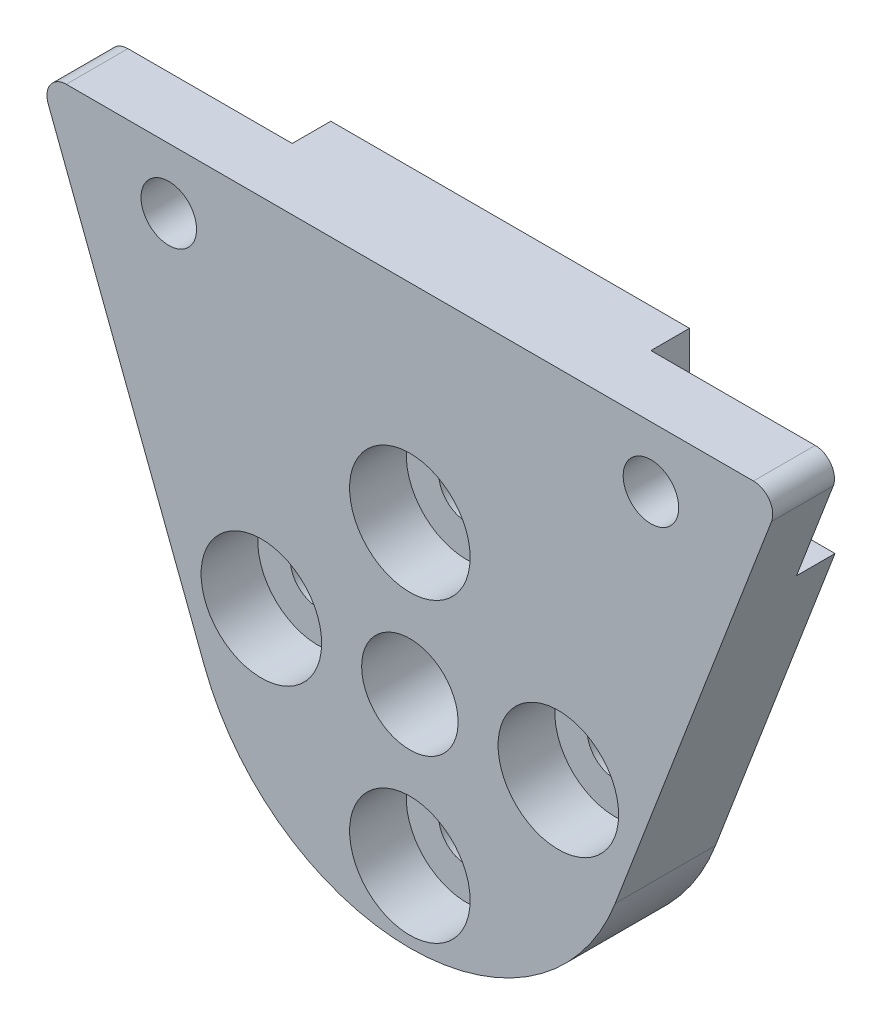
from build123d import *

# Parameters (mm, degrees)
SKETCH2_R                                           = 3.175
BOSS_EXTRUDE1_DEPTH                                 = 6.604
CBORE_FOR_6_BINDING_HEAD_MACHINE_SCREW1_D           = 3.6576
CBORE_FOR_6_BINDING_HEAD_MACHINE_SCREW1_CBORE_D     = 7.9375
CBORE_FOR_6_BINDING_HEAD_MACHINE_SCREW1_CBORE_DEPTH = 3.7338
F_6_CLEARANCE_HOLE1_D                               = 3.6576
CUT_EXTRUDE1_DEPTH                                  = 2.54
FILLET1_R                                           = 1.27


with BuildPart() as part:
    # Sketch2 → Boss-Extrude1 (new body)
    with BuildSketch(Plane.XY):
        with BuildLine():
            Line((24.4729, 18.9865), (13.523558965, -9.656158478))
            ThreePointArc((13.523558965, -9.656158478), (0, -18.964454722), (-13.523558965, -9.656158478))
            Line((-13.523558965, -9.656158478), (-24.4729, 18.9865))
            Line((-24.4729, 18.9865), (24.4729, 18.9865))
        make_face()
        with Locations(Location((0, -4.486454722, 0), (0, 0, 180))):
            Circle(SKETCH2_R, mode=Mode.SUBTRACT)
    extrude(amount=BOSS_EXTRUDE1_DEPTH)

    # CBORE for #6 Binding Head Machine Screw1 (through all)
    with Locations(Plane.XY.offset(6.604)):
        with Locations((0, -14.265454722), (0, 5.292545278), (9.779, -4.486454722), (-9.779, -4.486454722)):
            CounterBoreHole(CBORE_FOR_6_BINDING_HEAD_MACHINE_SCREW1_D / 2, CBORE_FOR_6_BINDING_HEAD_MACHINE_SCREW1_CBORE_D / 2, CBORE_FOR_6_BINDING_HEAD_MACHINE_SCREW1_CBORE_DEPTH)

    # #6 Clearance Hole1 (through all)
    with Locations(Plane(origin=(0, 0, 0), x_dir=(-1, 0, 0), z_dir=(0, 0, -1))):
        with Locations((15.875, 14.9987), (-15.875, 14.9987)):
            Hole(F_6_CLEARANCE_HOLE1_D / 2)

    # Sketch9 → Cut-Extrude1 (cut)
    with BuildSketch(Plane(origin=(0, 0, 0), x_dir=(-1, 0, 0), z_dir=(0, 0, -1))):
        with BuildLine():
            Line((-11.811, 14.9987), (-11.811, 18.9865))
            Line((-11.811, 18.9865), (-24.4729, 18.9865))
            Line((-24.4729, 18.9865), (-21.394906935, 10.9347))
            Line((-21.394906935, 10.9347), (-15.875, 10.9347))
            ThreePointArc((-15.875, 10.9347), (-13.001318041, 12.125018041), (-11.811, 14.9987))
        make_face()
        with BuildLine():
            Line((11.811, 14.9987), (11.811, 18.9865))
            Line((11.811, 18.9865), (24.4729, 18.9865))
            Line((24.4729, 18.9865), (21.394906935, 10.9347))
            Line((21.394906935, 10.9347), (15.875, 10.9347))
            ThreePointArc((15.875, 10.9347), (13.001318041, 12.125018041), (11.811, 14.9987))
        make_face()
    extrude(amount=-CUT_EXTRUDE1_DEPTH, mode=Mode.SUBTRACT)

    # Fillet1
    fillet1_edges = [part.edges().sort_by_distance(p)[0] for p in [
        (24.4729, 18.9865, 4.572),
        (-24.4729, 18.9865, 4.572),
    ]]
    fillet(fillet1_edges, radius=FILLET1_R)


solid = part.part
